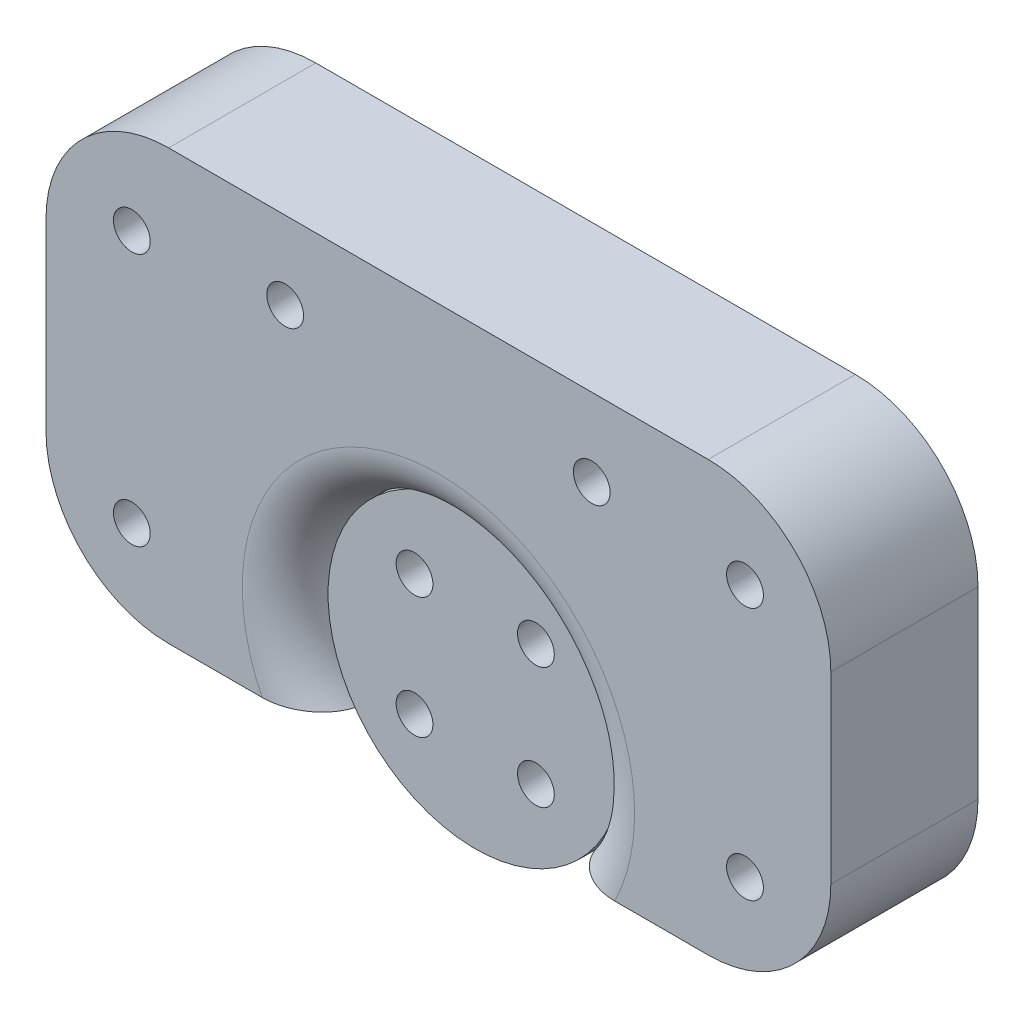
from build123d import *

# Parameters (mm, degrees)
SKETCH_1_R      = 12
SKETCH_1_R_2    = 1.5
EXTRUDE_1_DEPTH = 9
SKETCH_2_R      = 1.5
EXTRUDE_2_DEPTH = 12
FILLET_2_R      = 4
FILLET_3_R      = 10


with BuildPart() as part:
    # 草图1 → 凸台-拉伸1 (new body)
    with BuildSketch(Plane.XY):
        Circle(SKETCH_1_R)
        with Locations((-4.949747468, 4.949747468)):
            Circle(SKETCH_1_R_2, mode=Mode.SUBTRACT)
        with Locations((4.949747468, 4.949747468)):
            Circle(SKETCH_1_R_2, mode=Mode.SUBTRACT)
        with Locations((-4.949747468, -4.949747468)):
            Circle(SKETCH_1_R_2, mode=Mode.SUBTRACT)
        with Locations((4.949747468, -4.949747468)):
            Circle(SKETCH_1_R_2, mode=Mode.SUBTRACT)
    extrude(amount=EXTRUDE_1_DEPTH)


with BuildPart() as body_2:
    # 草图2 → 凸台-拉伸2 (new body)
    with BuildSketch(Plane(origin=(0, 0, 0), x_dir=(-1, 0, 0), z_dir=(0, 0, -1))):
        with BuildLine():
            Line((-18, -7), (-32, -7))
            Line((-32, -7), (-32, 28))
            Line((-32, 28), (32, 28))
            Line((32, 28), (32, -7))
            Line((32, -7), (18, -7))
            Line((18, -7), (9.7434736, -7))
            ThreePointArc((9.7434736, -7), (0, 11.997302938), (-9.7434736, -7))
            Line((-9.7434736, -7), (-18, -7))
        make_face()
        with Locations((-12.5, 21.65)):
            Circle(SKETCH_2_R, mode=Mode.SUBTRACT)
        with Locations((12.5, 21.65)):
            Circle(SKETCH_2_R, mode=Mode.SUBTRACT)
        with Locations((-25, 20.65)):
            Circle(SKETCH_2_R, mode=Mode.SUBTRACT)
        with Locations((25, 20.65)):
            Circle(SKETCH_2_R, mode=Mode.SUBTRACT)
        with Locations((-25, 0)):
            Circle(SKETCH_2_R, mode=Mode.SUBTRACT)
        with Locations((25, 0)):
            Circle(SKETCH_2_R, mode=Mode.SUBTRACT)
    extrude(amount=-EXTRUDE_2_DEPTH)

    # 圆角2
    fillet_2_edges = [body_2.edges().sort_by_distance(p)[0] for p in [
        (0, 11.997302938, 12),
    ]]
    fillet(fillet_2_edges, radius=FILLET_2_R)

    # 圆角3
    fillet_3_edges = [body_2.edges().sort_by_distance(p)[0] for p in [
        (32, 28, 6),
        (-32, 28, 6),
        (-32, -7, 6),
        (32, -7, 6),
    ]]
    fillet(fillet_3_edges, radius=FILLET_3_R)


solid = Compound([part.part, body_2.part])
